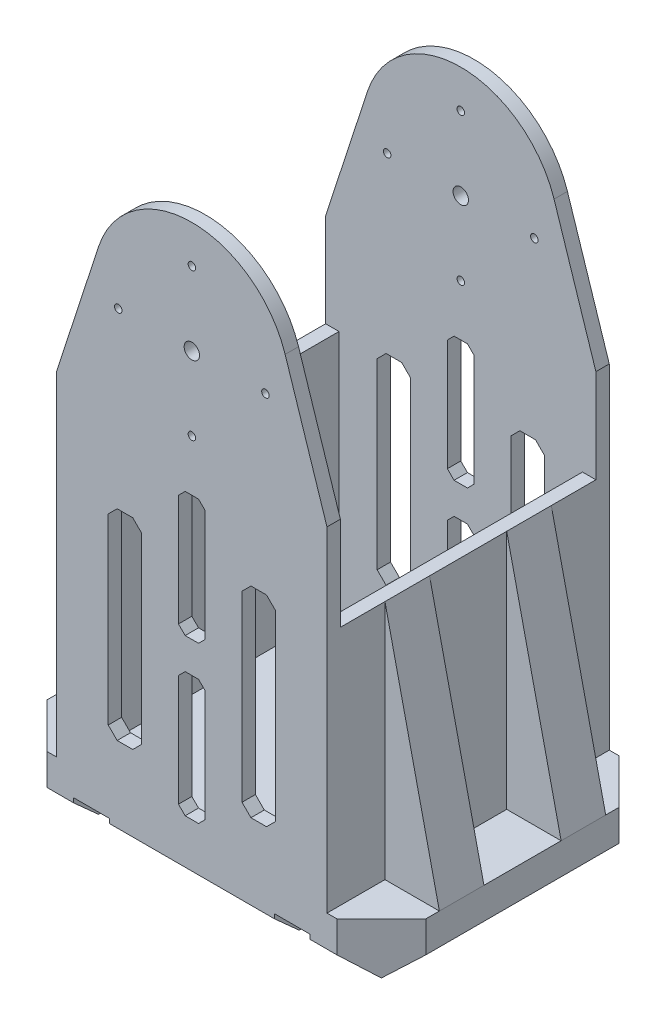
from build123d import *

# Parameters (mm, degrees)
SKETCH_1_W             = 60.6
SKETCH_1_H             = 63.3
SKETCH_1_W_2           = 54.6
SKETCH_1_H_2           = 57.3
EXTRUDE_1_DEPTH        = 60
SKETCH_2_W             = 60.6
SKETCH_2_H             = 3
EXTRUDE_2_DEPTH        = 65
CUT_EXTRUDE_1_DEPTH    = 65
SKETCH_9_R             = 1.725
CUT_EXTRUDE_4_DEPTH    = 80
SKETCH_10_W            = 85
SKETCH_10_H            = 63.3
EXTRUDE_3_DEPTH        = 6
CHAMFER_1_SIZE         = 10
CHAMFER_2_SIZE         = 5
CHAMFER_2_SIZE2        = 5.553062574
CHAMFER_2_PART_2_SIZE  = 5
CHAMFER_2_PART_2_SIZE2 = 5.553062574
CHAMFER_2_PART_3_SIZE  = 5
CHAMFER_2_PART_3_SIZE2 = 5.553062574
CHAMFER_2_PART_4_SIZE  = 5
CHAMFER_2_PART_4_SIZE2 = 5.553062574
SKETCH_12_W            = 8
SKETCH_12_H            = 6
CUT_EXTRUDE_5_DEPTH    = 80
SKETCH_13_W            = 37
SKETCH_13_H            = 10
CUT_EXTRUDE_7_DEPTH    = 6
SKETCH_14_W            = 37
SKETCH_14_H            = 12
CUT_EXTRUDE_8_DEPTH    = 0.3
EXTRUDE_4_DEPTH        = 5
MIRROR_2_COPY_1_DEPTH  = 5
SKETCH_8_R             = 0.84
CUT_EXTRUDE_9_DEPTH    = 80
CUT_EXTRUDE_10_DEPTH   = 80


with BuildPart() as part:
    # 草图1 → 凸台-拉伸1 (new body)
    with BuildSketch(Plane(origin=(0, 0, 0), x_dir=(1, 0, 0), z_dir=(0, 1, 0))):
        Rectangle(SKETCH_1_W, SKETCH_1_H)
        Rectangle(SKETCH_1_W_2, SKETCH_1_H_2, mode=Mode.SUBTRACT)
    extrude(amount=EXTRUDE_1_DEPTH)

    # 草图2 → 凸台-拉伸2 (add)
    with BuildSketch(Plane(origin=(0, 60, 0), x_dir=(1, 0, 0), z_dir=(0, 1, 0))):
        with Locations((0, 30.15)):
            Rectangle(SKETCH_2_W, SKETCH_2_H)
        with Locations((0, -30.15)):
            Rectangle(SKETCH_2_W, SKETCH_2_H)
    extrude(amount=EXTRUDE_2_DEPTH)

    # 草图3 → 切除-拉伸1 (cut)
    with BuildSketch(Plane(origin=(0, 0, -31.65), x_dir=(-1, 0, 0), z_dir=(0, 0, -1))):
        with BuildLine():
            Line((-30.3, 81), (-20.919056551, 109.811246068))
            ThreePointArc((-20.919056551, 109.811246068), (0, 125), (20.919056551, 109.811246068))
            Line((20.919056551, 109.811246068), (30.3, 81))
            Line((30.3, 81), (30.3, 183))
            Line((30.3, 183), (-30.3, 125))
            Line((-30.3, 125), (-30.3, 81))
        make_face()
    extrude(amount=-CUT_EXTRUDE_1_DEPTH, mode=Mode.SUBTRACT)

    # 草图9 → 切除-拉伸4 (cut)
    with BuildSketch(Plane(origin=(0, 0, -31.65), x_dir=(-1, 0, 0), z_dir=(0, 0, -1))):
        with Locations((0, 100)):
            Circle(SKETCH_9_R)
    extrude(amount=-CUT_EXTRUDE_4_DEPTH, mode=Mode.SUBTRACT)

    # 草图10 → 凸台-拉伸3 (add, symmetric)
    with BuildSketch(Plane.XZ):
        Rectangle(SKETCH_10_W, SKETCH_10_H)
    extrude(amount=EXTRUDE_3_DEPTH, both=True)

    # 倒角1
    chamfer_1_edges = [part.edges().sort_by_distance(p)[0] for p in [
        (42.5, 0, 31.65),
        (-42.5, 0, -31.65),
        (42.5, 0, -31.65),
        (-42.5, 0, 31.65),
    ]]
    chamfer(chamfer_1_edges, length=CHAMFER_1_SIZE)

    # 倒角2
    chamfer_2_edges = [part.edges().sort_by_distance(p)[0] for p in [
        (42.5, -6, 0),
    ]]
    chamfer_2_side = [part.faces().sort_by_distance(p)[0] for p in [
        (42.5, 0, 0),
    ]]
    chamfer(chamfer_2_edges, length=CHAMFER_2_SIZE, length2=CHAMFER_2_SIZE2, reference=chamfer_2_side[0])

    # 倒角2 part 2
    chamfer_2_part_2_edges = [part.edges().sort_by_distance(p)[0] for p in [
        (-42.5, -6, 0),
    ]]
    chamfer_2_part_2_side = [part.faces().sort_by_distance(p)[0] for p in [
        (-42.5, 0, 0),
    ]]
    chamfer(chamfer_2_part_2_edges, length=CHAMFER_2_PART_2_SIZE, length2=CHAMFER_2_PART_2_SIZE2, reference=chamfer_2_part_2_side[0])

    # 倒角2 part 3
    chamfer_2_part_3_edges = [part.edges().sort_by_distance(p)[0] for p in [
        (0, -6, -31.65),
    ]]
    chamfer_2_part_3_side = [part.faces().sort_by_distance(p)[0] for p in [
        (0, 53.785060823, -31.65),
    ]]
    chamfer(chamfer_2_part_3_edges, length=CHAMFER_2_PART_3_SIZE, length2=CHAMFER_2_PART_3_SIZE2, reference=chamfer_2_part_3_side[0])

    # 倒角2 part 4
    chamfer_2_part_4_edges = [part.edges().sort_by_distance(p)[0] for p in [
        (0, -6, 31.65),
    ]]
    chamfer_2_part_4_side = [part.faces().sort_by_distance(p)[0] for p in [
        (0, 53.785060823, 31.65),
    ]]
    chamfer(chamfer_2_part_4_edges, length=CHAMFER_2_PART_4_SIZE, length2=CHAMFER_2_PART_4_SIZE2, reference=chamfer_2_part_4_side[0])

    # 草图12 → 切除-拉伸5 (cut)
    with BuildSketch(Plane(origin=(0, 0, -31.65), x_dir=(-1, 0, 0), z_dir=(0, 0, -1))):
        with Locations((-22.5, -3)):
            Rectangle(SKETCH_12_W, SKETCH_12_H)
        with Locations((22.5, -3)):
            Rectangle(SKETCH_12_W, SKETCH_12_H)
    extrude(amount=-CUT_EXTRUDE_5_DEPTH, mode=Mode.SUBTRACT)

    # 草图13 → 切除-拉伸7 (cut)
    with BuildSketch(Plane.XZ.offset(6)):
        with Locations((0, 11)):
            Rectangle(SKETCH_13_W, SKETCH_13_H)
        with Locations((0, -11)):
            Rectangle(SKETCH_13_W, SKETCH_13_H)
    extrude(amount=-CUT_EXTRUDE_7_DEPTH, mode=Mode.SUBTRACT)

    # 草图14 → 切除-拉伸8 (cut)
    with BuildSketch(Plane.XZ.offset(6)):
        Rectangle(SKETCH_14_W, SKETCH_14_H)
    extrude(amount=-CUT_EXTRUDE_8_DEPTH, mode=Mode.SUBTRACT)

    # 草图18 → 凸台-拉伸4 (add, symmetric)
    with BuildSketch(Plane(origin=(0, 0, -13.65), x_dir=(-1, 0, 0), z_dir=(0, 0, -1))):
        Polygon((30.3, 60), (42.5, 6), (30.3, 6), align=None)
    extrude_4 = extrude(amount=EXTRUDE_4_DEPTH, both=True)

    # 镜向1: 凸台-拉伸4 across plane
    add(extrude_4.mirror(Plane.XY))

    # 镜向2: 凸台-拉伸4 across plane
    add(extrude_4.mirror(Plane(origin=(0, 0, 0), x_dir=(0, 0, 1), z_dir=(1, 0, 0))))

    # 镜向2 copy 1 sketch → 镜向2 copy 1 (add, symmetric)
    with BuildSketch(Plane.XY.offset(13.65)):
        Polygon((30.3, 60), (42.5, 6), (30.3, 6), align=None)
    extrude(amount=MIRROR_2_COPY_1_DEPTH, both=True)

    # 草图8 → 切除-拉伸9 (cut)
    with BuildSketch(Plane.XY.offset(31.65)):
        with Locations((0, 116.5)):
            Circle(SKETCH_8_R)
        with Locations((16.5, 100)):
            Circle(SKETCH_8_R)
        with Locations((0, 83.5)):
            Circle(SKETCH_8_R)
        with Locations((-16.5, 100)):
            Circle(SKETCH_8_R)
    extrude(amount=-CUT_EXTRUDE_9_DEPTH, mode=Mode.SUBTRACT)

    # 草图19 → 切除-拉伸10 (cut)
    with BuildSketch(Plane(origin=(0, 0, -31.65), x_dir=(-1, 0, 0), z_dir=(0, 0, -1))):
        Polygon((-1.5, 44), (1.5, 44), (3, 45.5), (3, 70.5), (1.5, 72), (-1.5, 72), (-3, 70.5), (-3, 45.5), align=None)
        Polygon((-16.75, 61), (-13.25, 61), (-11.25, 59), (-11.25, 18), (-13.25, 16), (-16.75, 16), (-18.75, 18), (-18.75, 59), align=None)
        Polygon((-3, 10.5), (-3, 35.5), (-1.5, 37), (1.5, 37), (3, 35.5), (3, 10.5), (1.5, 9), (-1.5, 9), align=None)
        Polygon((13.25, 16), (11.25, 18), (11.25, 59), (13.25, 61), (16.75, 61), (18.75, 59), (18.75, 18), (16.75, 16), align=None)
    extrude(amount=-CUT_EXTRUDE_10_DEPTH, mode=Mode.SUBTRACT)


solid = part.part
